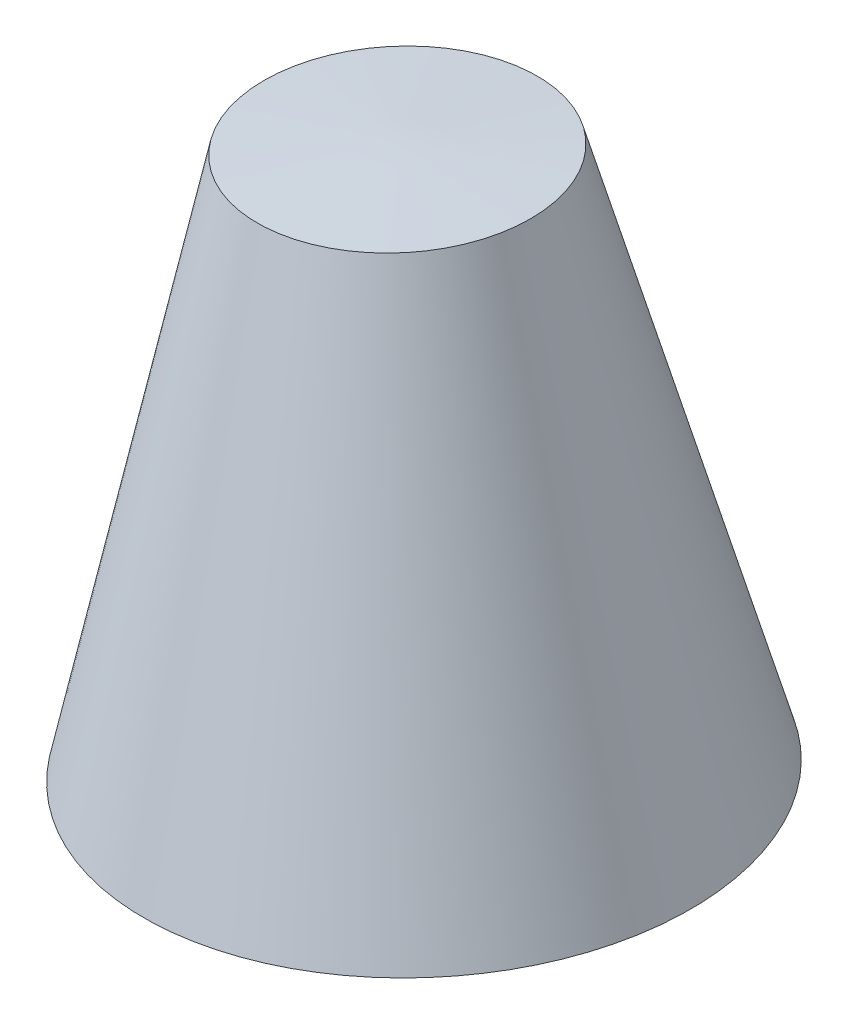
from build123d import *

# Parameters (mm, degrees)
SCALE1_SCALE = 3


with BuildPart() as part:
    # Sketch1 → Revolve1 (revolve)
    with BuildSketch(Plane.XY):
        Polygon((-24.230303665, 31.915288037), (-22.964541534, 6.961691725), (-10.446574453, 7.596661069), (-17.95521583, 31.915288037), align=None)
    revolve(axis=Axis((-24.230303665, 31.915288037, 0), (0.05065950637679531, -0.9987159828568177, 0)))


with BuildPart() as part_1:
    # Scale1: scaled about (-23.456880174, 16.667796342, 0)
    add(part.part.scale(SCALE1_SCALE).moved(Location((46.913760348, -33.335592684, 0))))


solid = part_1.part
